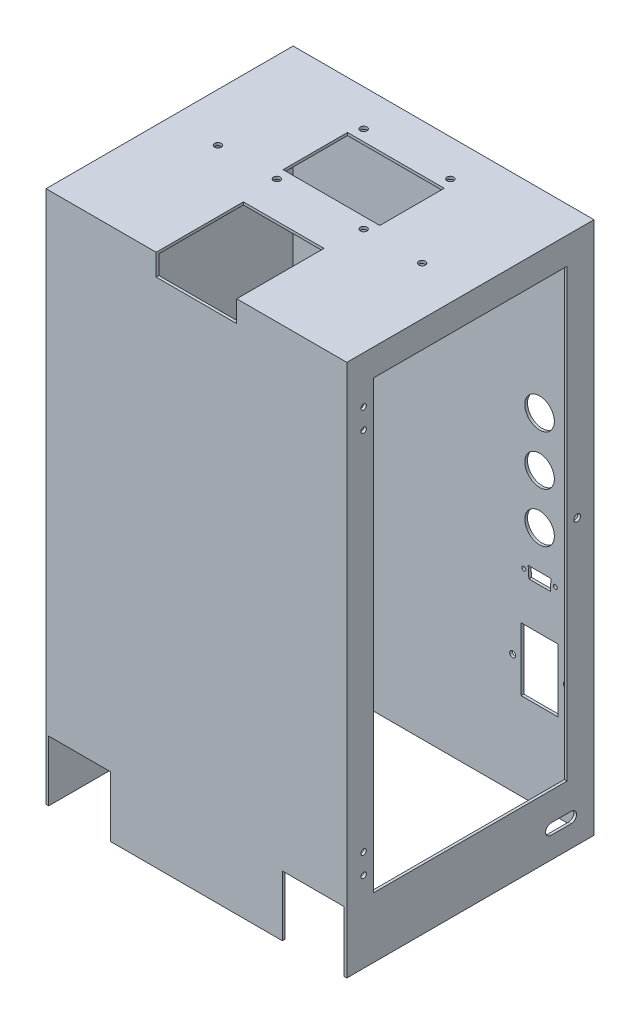
from build123d import *

# Parameters (mm, degrees)
SKETCH_1_W          = 220
SKETCH_1_H          = 180
EXTRUDE_1_DEPTH     = 395
SKETCH_17_W         = 46
SKETCH_17_H         = 45
CUT_EXTRUDE_2_DEPTH = 2
SKETCH_19_W         = 224
SKETCH_19_H         = 184
EXTRUDE_13_DEPTH    = 2
SKETCH_20_W         = 60
SKETCH_20_H         = 18
CUT_EXTRUDE_4_DEPTH = 65
SKETCH_21_W         = 144
SKETCH_21_H         = 332
CUT_EXTRUDE_5_DEPTH = 2
SKETCH_22_R         = 2.5
CUT_EXTRUDE_6_DEPTH = 10
SKETCH_23_R         = 11
SKETCH_23_R_2       = 2.25
SKETCH_23_R_3       = 1.5
CUT_EXTRUDE_7_DEPTH = 2
SKETCH_24_R         = 2
SKETCH_24_R_2       = 2.5
CUT_EXTRUDE_8_DEPTH = 3
CUT_EXTRUDE_9_DEPTH = 491.824815999
HOLE_WIZARD_M6_1_D  = 5


with BuildPart() as part:
    # 草图1 → 凸台-拉伸1 (new body)
    with BuildSketch(Plane(origin=(0, 0, 0), x_dir=(1, 0, 0), z_dir=(0, 1, 0))):
        Polygon((222, 2), (222, -182), (173, -182), (47, -182), (-2, -182), (-2, 2), align=None)
        with Locations((110, -90)):
            Rectangle(SKETCH_1_W, SKETCH_1_H, mode=Mode.SUBTRACT)
    extrude(amount=EXTRUDE_1_DEPTH)

    # 草图17 → 切除-拉伸2 (cut)
    with BuildSketch(Plane.XY.offset(182)):
        with Locations((23, 22.5)):
            Rectangle(SKETCH_17_W, SKETCH_17_H)
        with Locations((197, 22.5)):
            Rectangle(SKETCH_17_W, SKETCH_17_H)
    extrude(amount=-CUT_EXTRUDE_2_DEPTH, mode=Mode.SUBTRACT)

    # 草图19 → 凸台-拉伸13 (add)
    with BuildSketch(Plane(origin=(0, 395, 0), x_dir=(1, 0, 0), z_dir=(0, 1, 0))):
        with Locations((110, -90)):
            Rectangle(SKETCH_19_W, SKETCH_19_H)
    extrude(amount=EXTRUDE_13_DEPTH)

    # 草图20 → 切除-拉伸4 (cut)
    with BuildSketch(Plane.XY.offset(182)):
        with Locations((110, 390)):
            Rectangle(SKETCH_20_W, SKETCH_20_H)
    extrude(amount=-CUT_EXTRUDE_4_DEPTH, mode=Mode.SUBTRACT)

    # 草图21 → 切除-拉伸5 (cut)
    with BuildSketch(Plane(origin=(222, 0, 0), x_dir=(0, 0, -1), z_dir=(1, 0, 0))):
        with Locations((-90, 211)):
            Rectangle(SKETCH_21_W, SKETCH_21_H)
    extrude(amount=-CUT_EXTRUDE_5_DEPTH, mode=Mode.SUBTRACT)

    # 草图22 → 切除-拉伸6 (cut)
    with BuildSketch(Plane(origin=(0, 397, 0), x_dir=(1, 0, 0), z_dir=(0, 1, 0))):
        with Locations(Location((77.7, -25.2, 0), (0, 0, 270))):
            Circle(SKETCH_22_R)
        with Locations(Location((77.7, -89.8, 0), (0, 0, 270))):
            Circle(SKETCH_22_R)
        with Locations(Location((142.3, -89.8, 0), (0, 0, 270))):
            Circle(SKETCH_22_R)
        with Locations(Location((142.3, -25.2, 0), (0, 0, 270))):
            Circle(SKETCH_22_R)
        Polygon((74, -57.5), (74, -81.5), (146, -81.5), (146, -33.5), (74, -33.5), align=None)
    extrude(amount=-CUT_EXTRUDE_6_DEPTH, mode=Mode.SUBTRACT)

    # 草图23 → 切除-拉伸7 (cut)
    with BuildSketch(Plane(origin=(0, 0, -2), x_dir=(-1, 0, 0), z_dir=(0, 0, -1))):
        with Locations((-183.5, 217.109875683)):
            Circle(SKETCH_23_R)
        with Locations((-203.5, 88.459875683)):
            Circle(SKETCH_23_R_2)
        with Locations((-163.5, 88.459875683)):
            Circle(SKETCH_23_R_2)
        with Locations((-183.5, 180.109875683)):
            Circle(SKETCH_23_R)
        with Locations((-183.5, 254.109875683)):
            Circle(SKETCH_23_R)
        with Locations((-171.8, 147.859875683)):
            Circle(SKETCH_23_R_3)
        with Locations(Location((-195.2, 147.859875683, 0), (0, 0, 180))):
            Circle(SKETCH_23_R_3)
        Polygon((-183.5, 111.959875683), (-197.25, 111.959875683), (-197.25, 64.959875683), (-169.75, 64.959875683), (-169.75, 111.959875683), align=None)
        Polygon((-183.5, 151.609875683), (-175, 151.609875683), (-175.5, 143.109875683), (-183.5, 143.109875683), (-191.5, 143.109875683), (-192, 151.609875683), align=None)
    extrude(amount=-CUT_EXTRUDE_7_DEPTH, mode=Mode.SUBTRACT)

    # 草图24 → 切除-拉伸8 (cut)
    with BuildSketch(Plane(origin=(222, 0, 0), x_dir=(0, 0, -1), z_dir=(1, 0, 0))):
        with Locations((-169.5, 362)):
            Circle(SKETCH_24_R)
        with Locations((-169.5, 347)):
            Circle(SKETCH_24_R)
        with Locations(Location((-169.5, 75, 0), (0, 0, 180))):
            Circle(SKETCH_24_R)
        with Locations(Location((-169.5, 60, 0), (0, 0, 180))):
            Circle(SKETCH_24_R)
        with Locations((-10.5, 211)):
            Circle(SKETCH_24_R_2)
    extrude(amount=-CUT_EXTRUDE_8_DEPTH, mode=Mode.SUBTRACT)

    # 草图25 → 切除-拉伸9 (cut, through all)
    with BuildSketch(Plane(origin=(222, 0, 0), x_dir=(0, 0, -1), z_dir=(1, 0, 0))):
        with BuildLine():
            Line((-15, 16), (-30, 16))
            ThreePointArc((-30, 16), (-34, 20), (-30, 24))
            Line((-30, 24), (-15, 24))
            ThreePointArc((-15, 24), (-11, 20), (-15, 16))
        make_face()
    extrude(amount=-CUT_EXTRUDE_9_DEPTH, mode=Mode.SUBTRACT)

    # M6 螺纹孔1 (through all)
    with Locations(Plane(origin=(0, 397, 0), x_dir=(1, 0, 0), z_dir=(0, 1, 0))):
        with Locations((186, -90), (34, -90)):
            Hole(HOLE_WIZARD_M6_1_D / 2)


solid = part.part
